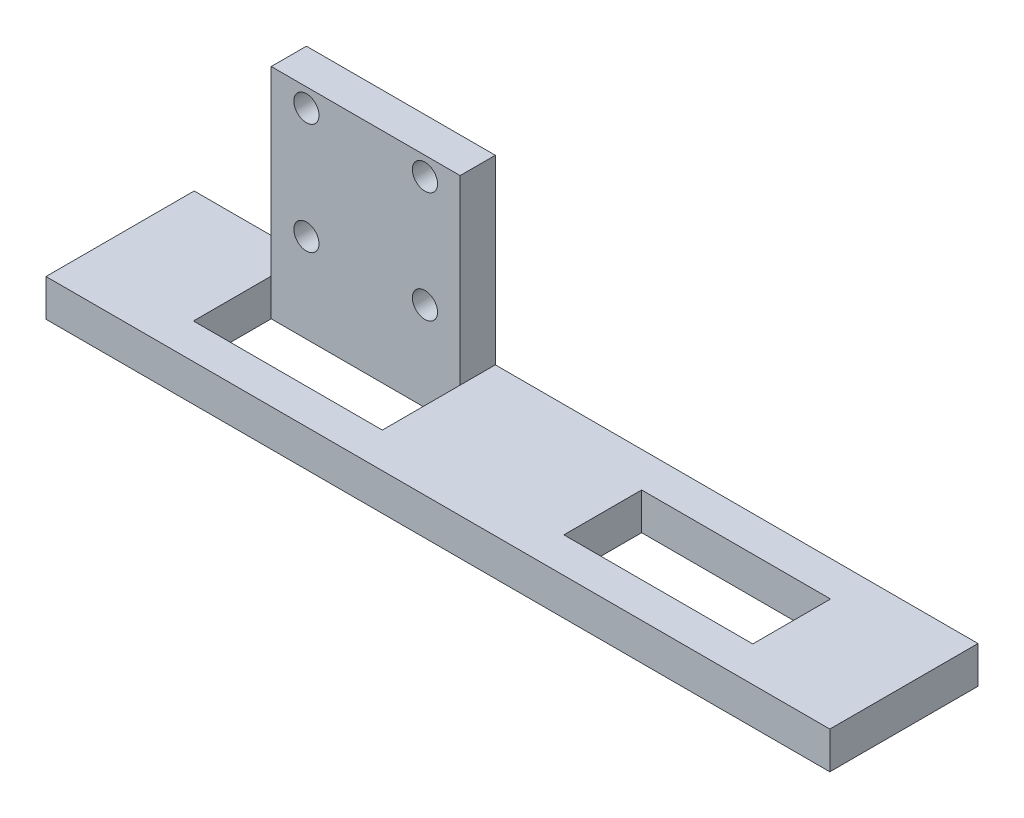
from build123d import *

# Parameters (mm, degrees)
SKETCH1_W           = 105.8
SKETCH1_H           = 20
SKETCH1_W_2         = 25.5
SKETCH1_H_2         = 10.5
BOSS_EXTRUDE1_DEPTH = 5
SKETCH2_W           = 25.5
SKETCH2_H           = 4.75
BOSS_EXTRUDE2_DEPTH = 24.5
SKETCH3_R           = 1.7
CUT_EXTRUDE1_DEPTH  = 5


with BuildPart() as part:
    # Sketch1 → Boss-Extrude1 (new body)
    with BuildSketch(Plane(origin=(0, 0, 0), x_dir=(1, 0, 0), z_dir=(0, 1, 0))):
        Rectangle(SKETCH1_W, SKETCH1_H)
        with Locations((25, 0)):
            Rectangle(SKETCH1_W_2, SKETCH1_H_2, mode=Mode.SUBTRACT)
        with Locations((-25, 0)):
            Rectangle(SKETCH1_W_2, SKETCH1_H_2, mode=Mode.SUBTRACT)
    extrude(amount=BOSS_EXTRUDE1_DEPTH)

    # Sketch2 → Boss-Extrude2 (add)
    with BuildSketch(Plane(origin=(0, 5, 0), x_dir=(1, 0, 0), z_dir=(0, 1, 0))):
        with Locations((-25, 7.625)):
            Rectangle(SKETCH2_W, SKETCH2_H)
    extrude(amount=BOSS_EXTRUDE2_DEPTH)

    # Sketch3 → Cut-Extrude1 (cut)
    with BuildSketch(Plane(origin=(0, 0, -10), x_dir=(-1, 0, 0), z_dir=(0, 0, -1))):
        with Locations((33, 27)):
            Circle(SKETCH3_R)
        with Locations((33, 12)):
            Circle(SKETCH3_R)
        with Locations((17, 12)):
            Circle(SKETCH3_R)
        with Locations((17, 27)):
            Circle(SKETCH3_R)
    extrude(amount=-CUT_EXTRUDE1_DEPTH, mode=Mode.SUBTRACT)


solid = part.part
